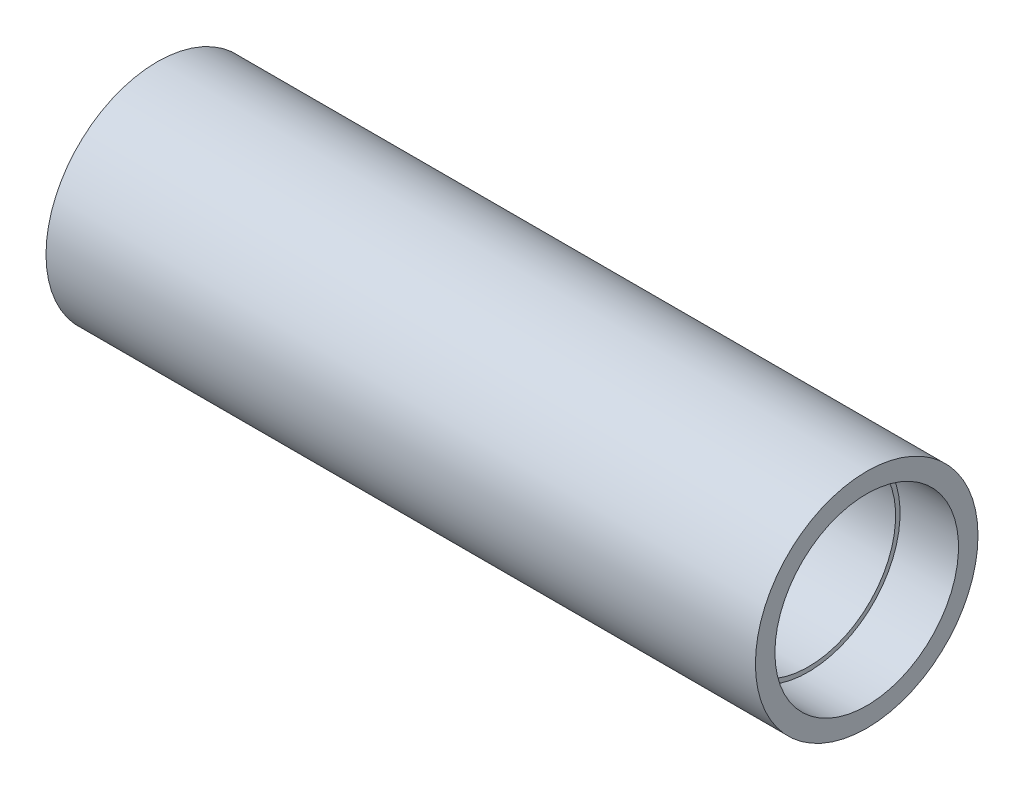
from build123d import *


with BuildPart() as part:
    # Sketch2 → Revolve1 (revolve)
    with BuildSketch(Plane(origin=(0, 0, 0), x_dir=(1, 0, 0), z_dir=(0, 1, 0)), mode=Mode.PRIVATE) as revolve1_sk:
        Polygon((42.5, 13.335), (-42.5, 13.335), (-42.5, 11), (-35.5, 11), (-35.5, 10.4648), (35.5, 10.4648), (35.5, 11), (42.5, 11), align=None)
    revolve(revolve1_sk.sketch.rotate(Axis((-42.5, 0, 0), (1, 0, 0)), 180), axis=Axis((-42.5, 0, 0), (1, 0, 0)))


solid = part.part
